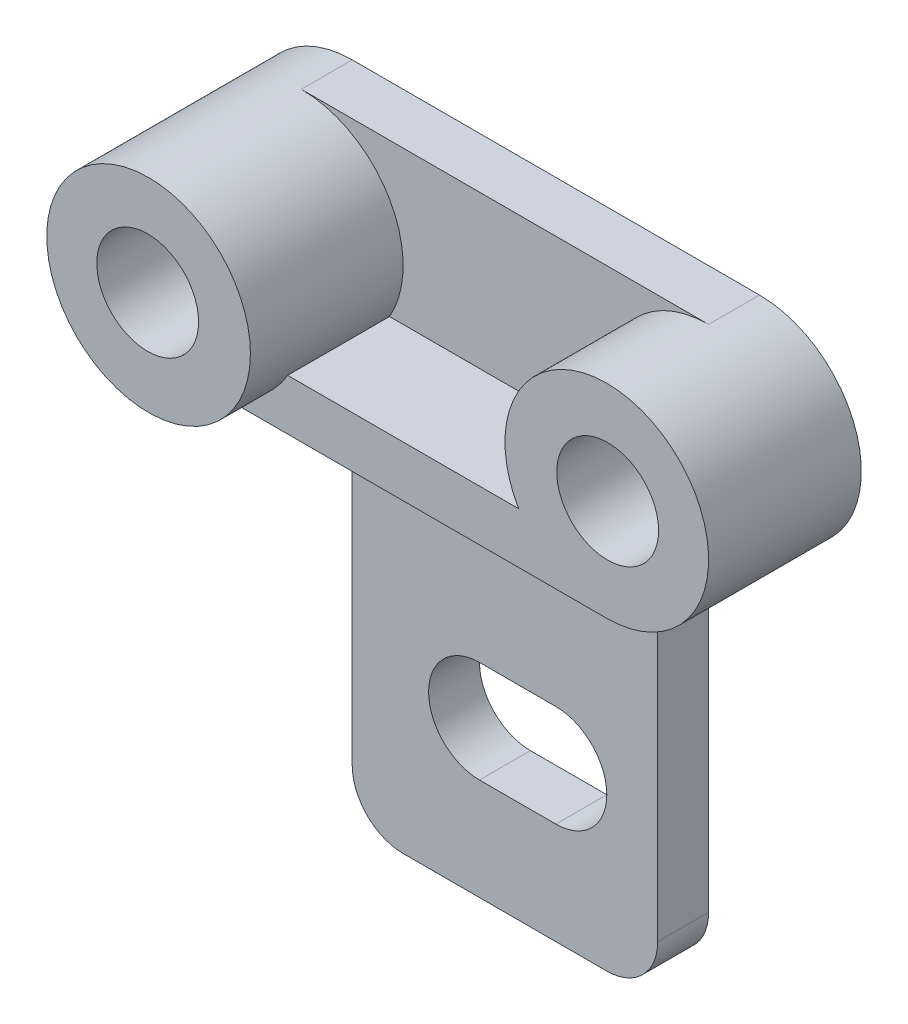
from build123d import *

# Parameters (mm, degrees)
SKETCH1_R              = 20
BOSS_EXTRUDE1_DEPTH    = 40
SKETCH1_3_R            = 20
BOSS_EXTRUDE2_DEPTH    = 30
SKETCH2_W              = 80
SKETCH2_H              = 40
BOSS_EXTRUDE3_DEPTH    = 10
SKETCH3_W              = 80
SKETCH3_H              = 10
BOSS_EXTRUDE4_DEPTH    = 30
F_20_0MM_DOWEL_HOLE1_D = 20
BOSS_EXTRUDE5_DEPTH    = 10
CUT_EXTRUDE1_DEPTH     = 121.415945788


with BuildPart() as part:
    # Sketch1 → Boss-Extrude1 (new body)
    with BuildSketch(Plane.XY):
        with Locations((-40, 0)):
            Circle(SKETCH1_R)
    extrude(amount=BOSS_EXTRUDE1_DEPTH)



with BuildPart() as body_2:
    # Sketch1<3> → Boss-Extrude2 (new body)
    with BuildSketch(Plane.XY):
        with Locations((40, 0)):
            Circle(SKETCH1_3_R)
    extrude(amount=BOSS_EXTRUDE2_DEPTH)


with BuildPart() as part_1:
    add(part.part)

    add(body_2.part)  # Boss-Extrude3 merges body 2
    # Sketch2 → Boss-Extrude3 (add)
    with BuildSketch(Plane(origin=(0, 0, 0), x_dir=(-1, 0, 0), z_dir=(0, 0, -1))):
        Rectangle(SKETCH2_W, SKETCH2_H)
    extrude(amount=-BOSS_EXTRUDE3_DEPTH)

    # Sketch3 → Boss-Extrude4 (add)
    with BuildSketch(Plane.XY.offset(30)):
        with Locations((0, -15)):
            Rectangle(SKETCH3_W, SKETCH3_H)
    extrude(amount=-BOSS_EXTRUDE4_DEPTH)

    # Ø20.0mm Dowel Hole1 (through all)
    with Locations(Plane.XY.offset(40)):
        with Locations((-40.178209802, 0.324017821), (40.178209802, 0)):
            Hole(F_20_0MM_DOWEL_HOLE1_D / 2)

    # Sketch9 → Boss-Extrude5 (add)
    with BuildSketch(Plane(origin=(0, 0, 0), x_dir=(-1, 0, 0), z_dir=(0, 0, -1))):
        with BuildLine():
            Line((-30, -20), (30, -20))
            Line((30, -20), (30, -90))
            ThreePointArc((30, -90), (27.071067812, -97.071067812), (20, -100))
            Line((20, -100), (-20, -100))
            ThreePointArc((-20, -100), (-27.071067812, -97.071067812), (-30, -90))
            Line((-30, -90), (-30, -20))
        make_face()
    extrude(amount=-BOSS_EXTRUDE5_DEPTH)

    # Sketch10 → Cut-Extrude1 (cut, through all)
    with BuildSketch(Plane.XY.offset(10)):
        with BuildLine():
            Line((-5, -60), (10, -60))
            ThreePointArc((10, -60), (20, -70), (10, -80))
            Line((10, -80), (-5, -80))
            ThreePointArc((-5, -80), (-15, -70), (-5, -60))
        make_face()
    extrude(amount=-CUT_EXTRUDE1_DEPTH, mode=Mode.SUBTRACT)


solid = part_1.part
